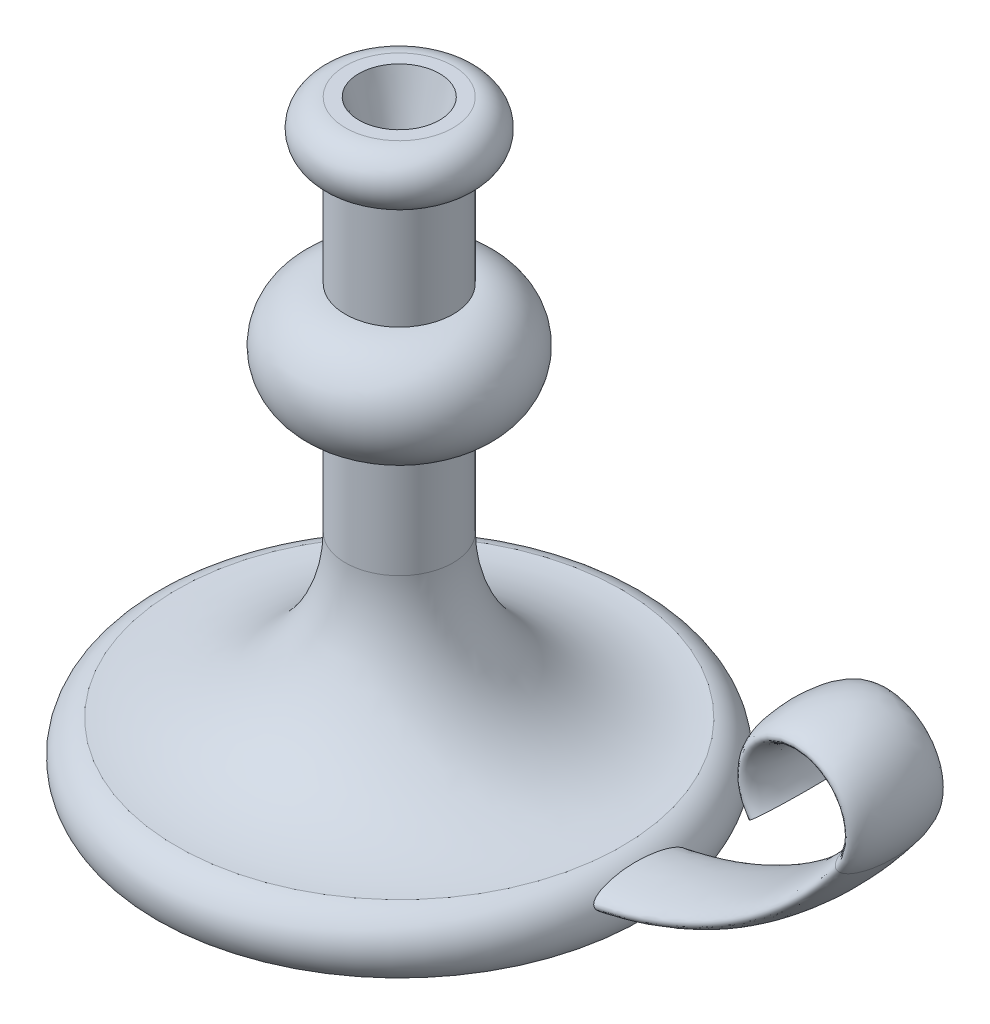
from build123d import *

# Parameters (mm, degrees)
SZKIC3_RX                  = 17.5
SZKIC3_RY                  = 5
SZKIC4_R                   = 15
WYTNIJ_WYCI_GNI_CIE1_DEPTH = 25
WYTNIJ_WYCI_GNI_CIE1_DRAFT = -15


with BuildPart() as part:
    # Szkic1 → Obrót1 (revolve)
    with BuildSketch(Plane.XY, mode=Mode.PRIVATE) as obr_t1_sk:
        with BuildLine():
            Line((0, 0), (0, 220))
            Line((0, 220), (20, 220))
            ThreePointArc((20, 220), (30, 210), (20, 200))
            Line((20, 200), (20, 160))
            ThreePointArc((20, 160), (40, 140), (20, 120))
            Line((20, 120), (20, 80))
            ThreePointArc((20, 80), (38.536214951, 36.632333134), (82.691817647, 20.060412766))
            ThreePointArc((82.691817647, 20.060412766), (91.980374519, 12.082891103), (90, 0))
            Line((90, 0), (0, 0))
        make_face()
    revolve(obr_t1_sk.sketch.rotate(Axis((0, 0, 0), (0, 1, 0)), 90), axis=Axis((0, 0, 0), (0, 1, 0)))

    # Wyciągnięcie po ścieżce1: sweep along a path in Szkic2
    with BuildLine(Plane.XY) as wyci_gni_cie_po_cie_ce1_path:
        Line((0, 10), (60, 10))
        ThreePointArc((60, 10), (127.082039325, 25.83592135), (180, 70))
        ThreePointArc((180, 70), (164, 102), (148, 70))
    # Szkic3 → Wyciągnięcie po ścieżce1 (sweep)
    with BuildSketch(Plane(origin=(0, 0, 0), x_dir=(0, 0, -1), z_dir=(1, 0, 0))):
        with Locations((0, 10)):
            Ellipse(SZKIC3_RX, SZKIC3_RY)
    sweep(path=wyci_gni_cie_po_cie_ce1_path.line)


with BuildPart() as wytnij_wyci_gni_cie1_tool:
    # Szkic4 → Wytnij-wyciągnięcie1 (with draft: the straight prism first)
    with BuildSketch(Plane(origin=(0, 220, 0), x_dir=(1, 0, 0), z_dir=(0, 1, 0))):
        Circle(SZKIC4_R)
    extrude(amount=-WYTNIJ_WYCI_GNI_CIE1_DEPTH)
    # Wytnij-wyciągnięcie1: the draft: its side faces are tilted about the plane it starts from
    wytnij_wyci_gni_cie1_sides = [wytnij_wyci_gni_cie1_tool.faces().sort_by_distance(p)[0] for p in [
        (-15, 207.5, 0),
    ]]
    draft(wytnij_wyci_gni_cie1_sides, Plane(origin=(0, 220, 0), x_dir=(1, 0, 0), z_dir=(0, 1, 0)), WYTNIJ_WYCI_GNI_CIE1_DRAFT)


with BuildPart() as part_1:
    add(part.part)

    # Wytnij-wyciągnięcie1: cut by wytnij_wyci_gni_cie1_tool
    add(wytnij_wyci_gni_cie1_tool.part, mode=Mode.SUBTRACT)


solid = part_1.part
